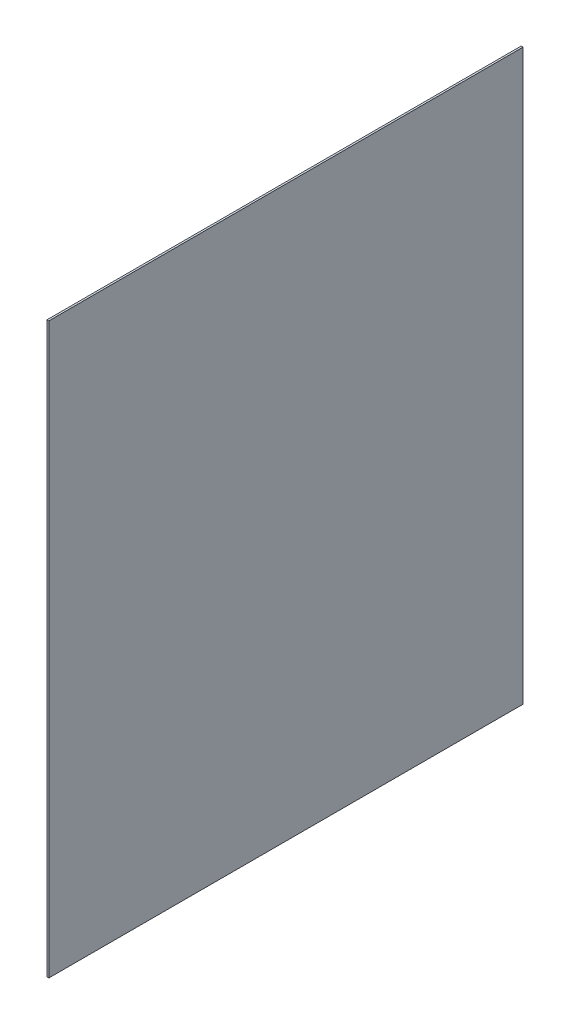
from build123d import *

# Parameters (mm, degrees)
SKETCH1_W           = 10
SKETCH1_H           = 3000
BOSS_EXTRUDE1_DEPTH = 2500


with BuildPart() as part:
    # Sketch1 → Boss-Extrude1 (new body)
    with BuildSketch(Plane.XY):
        Rectangle(SKETCH1_W, SKETCH1_H)
    extrude(amount=BOSS_EXTRUDE1_DEPTH)


solid = part.part
